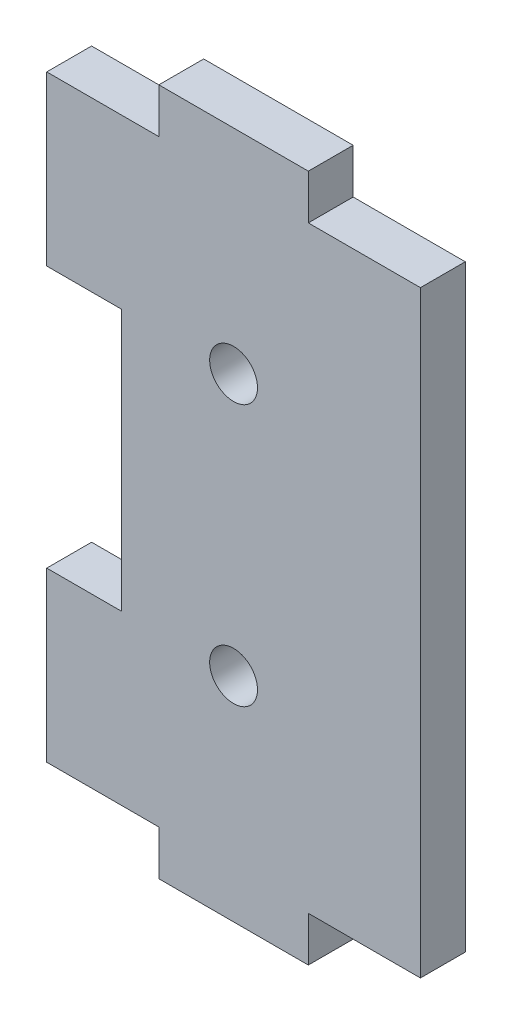
from build123d import *

# Parameters (mm, degrees)
SKETCH1_R           = 1.6
BOSS_EXTRUDE1_DEPTH = 3


with BuildPart() as part:
    # Sketch1 → Boss-Extrude1 (new body)
    with BuildSketch(Plane.XY):
        Polygon((-5, 20), (-5, 23), (5, 23), (5, 20), (12.5, 20), (12.5, -20), (5, -20), (5, -23), (-5, -23), (-5, -20), (-12.5, -20), (-12.5, -8.75), (-7.5, -8.75), (-7.5, 8.75), (-12.5, 8.75), (-12.5, 20), align=None)
        with Locations((0, 8.75)):
            Circle(SKETCH1_R, mode=Mode.SUBTRACT)
        with Locations((0, -8.75)):
            Circle(SKETCH1_R, mode=Mode.SUBTRACT)
    extrude(amount=BOSS_EXTRUDE1_DEPTH)


solid = part.part
